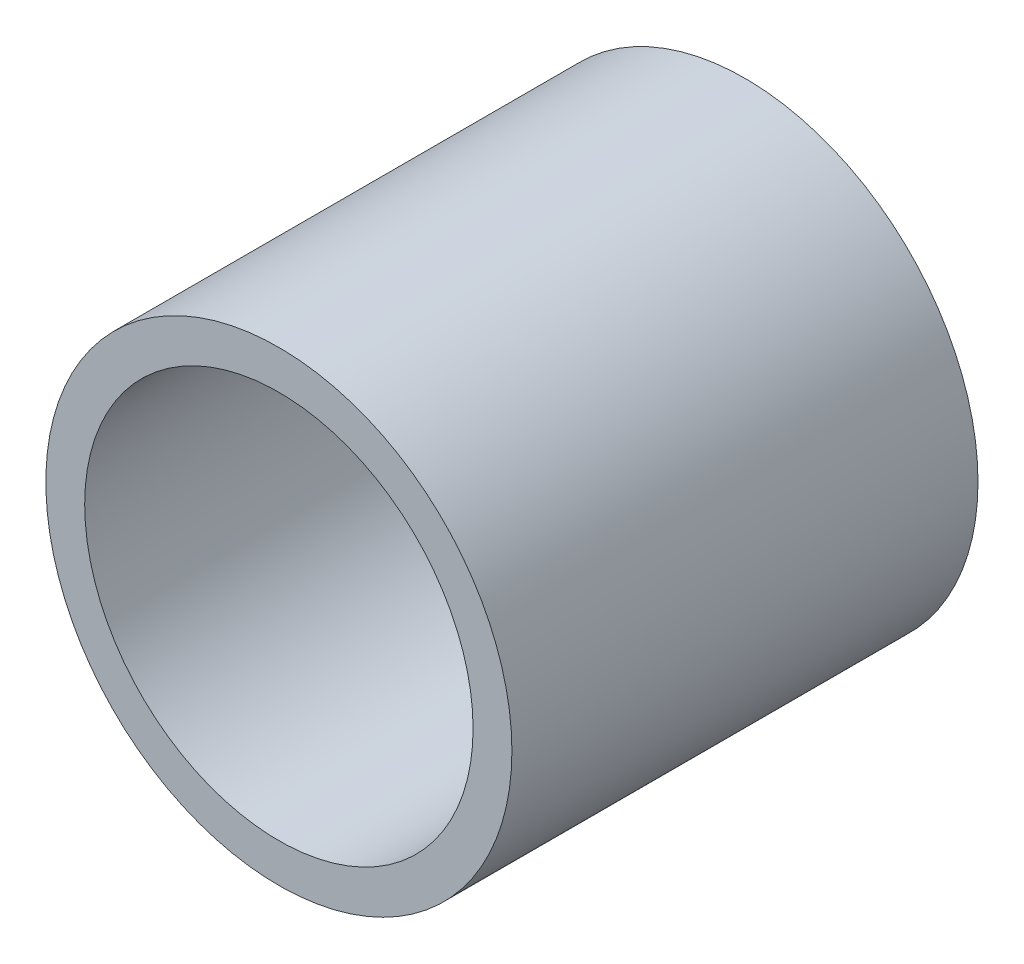
from build123d import *

# Parameters (mm, degrees)
SKETCH_1_R      = 6
SKETCH_1_R_2    = 5
EXTRUDE_1_DEPTH = 12


with BuildPart() as part:
    # 草图1 → 凸台-拉伸1 (new body)
    with BuildSketch(Plane.XY):
        Circle(SKETCH_1_R)
        Circle(SKETCH_1_R_2, mode=Mode.SUBTRACT)
    extrude(amount=EXTRUDE_1_DEPTH)


solid = part.part
